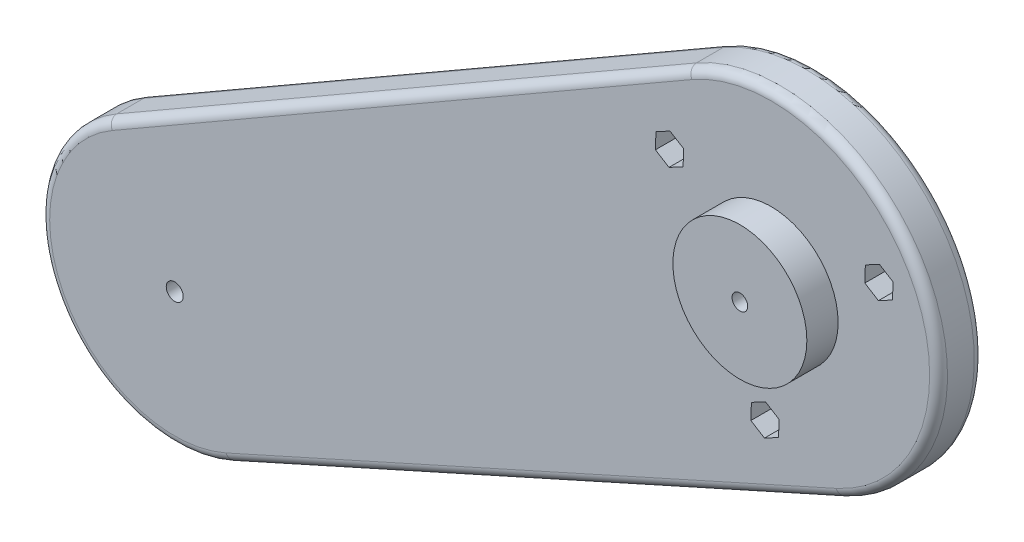
from build123d import *

# Parameters (mm, degrees)
BOSS_EXTRUDE1_DEPTH = 10
FILLET1_R           = 2
CUT_EXTRUDE8_DEPTH  = 5
CUT_EXTRUDE9_START  = -70
SKETCH10_R          = 1.75
CUT_EXTRUDE9_DEPTH  = 71
CIRPATTERN1_COUNT   = 3
SKETCH12_R          = 15
BOSS_EXTRUDE2_DEPTH = 7
CUT_EXTRUDE11_DEPTH = 5
SKETCH15_R          = 1.9
CUT_EXTRUDE12_DEPTH = 5
SKETCH16_R          = 1.75
CUT_EXTRUDE13_DEPTH = 18


with BuildPart() as part:
    # Sketch1 → Boss-Extrude1 (new body)
    with BuildSketch(Plane.XY):
        with BuildLine():
            Line((-148.531383238, -42.289811934), (-18.719283585, 32.493667415))
            ThreePointArc((-18.719283585, 32.493667415), (33.388989093, 17.071186467), (15.380384675, -34.200786062))
            Line((15.380384675, -34.200786062), (-121.25164863, -95.645374716))
            ThreePointArc((-121.25164863, -95.645374716), (-160.267147644, -81.941695039), (-148.531383238, -42.289811934))
        make_face()
    extrude(amount=BOSS_EXTRUDE1_DEPTH)

    # Fillet1
    fillet1_edges = [part.edges().sort_by_distance(p)[0] for p in [
        (33.388989093, 17.071186467, 10),
        (-83.625333411, -4.89807226, 10),
        (-160.267147644, -81.941695039, 10),
        (-83.625333411, -4.89807226, 0),
        (33.388989093, 17.071186467, 0),
        (-52.935631977, -64.923080389, 0),
        (-160.267147644, -81.941695039, 0),
        (-52.935631977, -64.923080389, 10),
    ]]
    fillet(fillet1_edges, radius=FILLET1_R)

    # Sketch3 → Cut-Extrude8 (cut)
    with BuildSketch(Plane.XY.offset(10)):
        Polygon((-4.424109202, -25.18892785), (-4.53581637, -28.767184619), (-1.492808691, -30.65305425), (1.661906157, -28.96066711), (1.773613325, -25.382410341), (-1.269394354, -23.496540711), align=None)
        Polygon((27.292728029, 14.033716876), (24.249720349, 15.919586506), (21.095005502, 14.227199366), (20.983298334, 10.648942597), (24.026306013, 8.763072967), (27.181020861, 10.455460106), align=None)
        Polygon((-19.602196811, 16.425854883), (-22.645204491, 18.311724513), (-25.799919338, 16.619337374), (-25.911626506, 13.041080604), (-22.868618827, 11.155210974), (-19.713903979, 12.847598114), align=None)
    extrude(amount=-CUT_EXTRUDE8_DEPTH, mode=Mode.SUBTRACT)

    # Sketch10 → Cut-Extrude9 (cut)
    with BuildSketch(Plane.XY.offset(5).offset(CUT_EXTRUDE9_START)):
        with Locations((24.040072147, 12.291254256)):
            Circle(SKETCH10_R)
    cut_extrude9 = extrude(amount=CUT_EXTRUDE9_DEPTH, mode=Mode.SUBTRACT)

    # CirPattern1: Cut-Extrude9 ×3 about axis
    cirpattern1_axis = Axis((0, 0, 0), (0, 0, 1))
    for i in range(1, CIRPATTERN1_COUNT):
        add(cut_extrude9.rotate(cirpattern1_axis, i * 360 / CIRPATTERN1_COUNT), mode=Mode.SUBTRACT)

    # Sketch12 → Boss-Extrude2 (add)
    with BuildSketch(Plane.XY.offset(10)):
        Circle(SKETCH12_R)
    extrude(amount=BOSS_EXTRUDE2_DEPTH)

    # Sketch14 → Cut-Extrude11 (cut)
    with BuildSketch(Plane(origin=(0, 0, 0), x_dir=(-1, 0, 0), z_dir=(0, 0, -1))):
        Polygon((137.13595637, -68.284745866), (135.34595637, -65.184374921), (131.76595637, -65.184374921), (129.97595637, -68.284745866), (131.76595637, -71.385116812), (135.34595637, -71.385116812), align=None)
    extrude(amount=-CUT_EXTRUDE11_DEPTH, mode=Mode.SUBTRACT)

    # Sketch15 → Cut-Extrude12 (cut)
    with BuildSketch(Plane(origin=(0, 0, 5), x_dir=(-1, 0, 0), z_dir=(0, 0, -1))):
        with Locations((133.55595637, -68.284745866)):
            Circle(SKETCH15_R)
    extrude(amount=-CUT_EXTRUDE12_DEPTH, mode=Mode.SUBTRACT)

    # Sketch16 → Cut-Extrude13 (cut)
    with BuildSketch(Plane(origin=(0, 0, 0), x_dir=(-1, 0, 0), z_dir=(0, 0, -1))):
        Circle(SKETCH16_R)
    extrude(amount=-CUT_EXTRUDE13_DEPTH, mode=Mode.SUBTRACT)


solid = part.part
